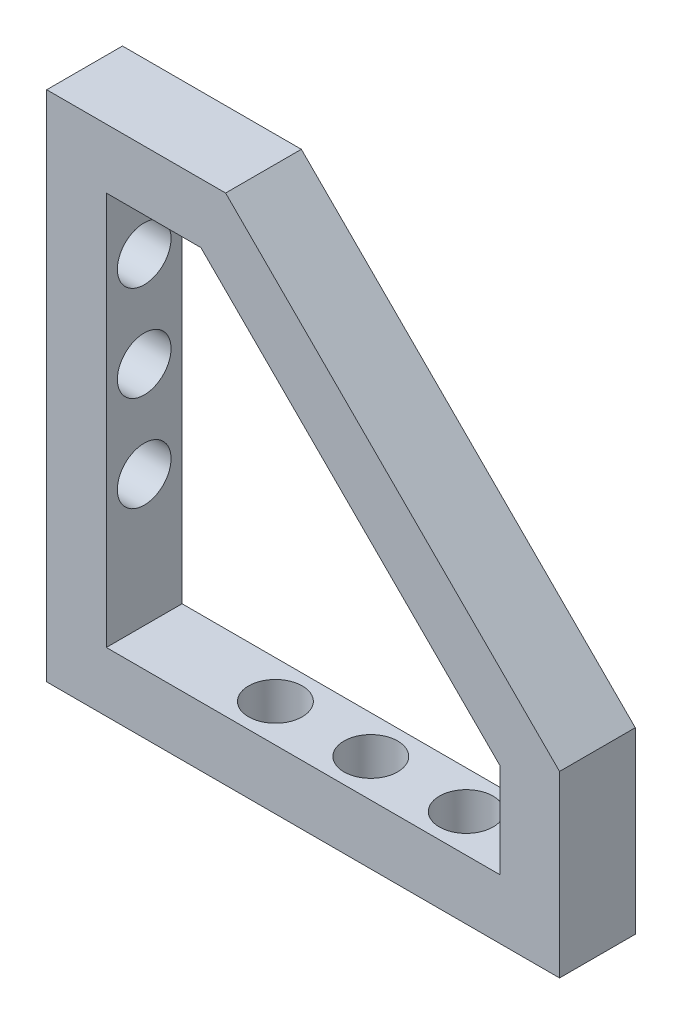
from build123d import *

# Parameters (mm, degrees)
BOSS_EXTRUDE1_DEPTH = 6.35
SKETCH2_R           = 2.25
CUT_EXTRUDE1_DEPTH  = 5
SKETCH3_R           = 2.25
CUT_EXTRUDE2_DEPTH  = 5


with BuildPart() as part:
    # Sketch1 → Boss-Extrude1 (new body)
    with BuildSketch(Plane.XY):
        Polygon((0, 0), (0, 43), (15, 43), (43, 15), (43, 0), align=None)
        Polygon((38, 5), (5, 5), (5, 38), (12.928932188, 38), (38, 12.928932188), align=None, mode=Mode.SUBTRACT)
    extrude(amount=BOSS_EXTRUDE1_DEPTH)

    # Sketch2 → Cut-Extrude1 (cut)
    with BuildSketch(Plane.XZ):
        with Locations((16, 3.175)):
            Circle(SKETCH2_R)
        with Locations((24, 3.175)):
            Circle(SKETCH2_R)
        with Locations((32, 3.175)):
            Circle(SKETCH2_R)
    extrude(amount=-CUT_EXTRUDE1_DEPTH, mode=Mode.SUBTRACT)

    # Sketch3 → Cut-Extrude2 (cut)
    with BuildSketch(Plane.ZY):
        with Locations((3.175, 16)):
            Circle(SKETCH3_R)
        with Locations((3.175, 24)):
            Circle(SKETCH3_R)
        with Locations((3.175, 32)):
            Circle(SKETCH3_R)
    extrude(amount=-CUT_EXTRUDE2_DEPTH, mode=Mode.SUBTRACT)


solid = part.part
